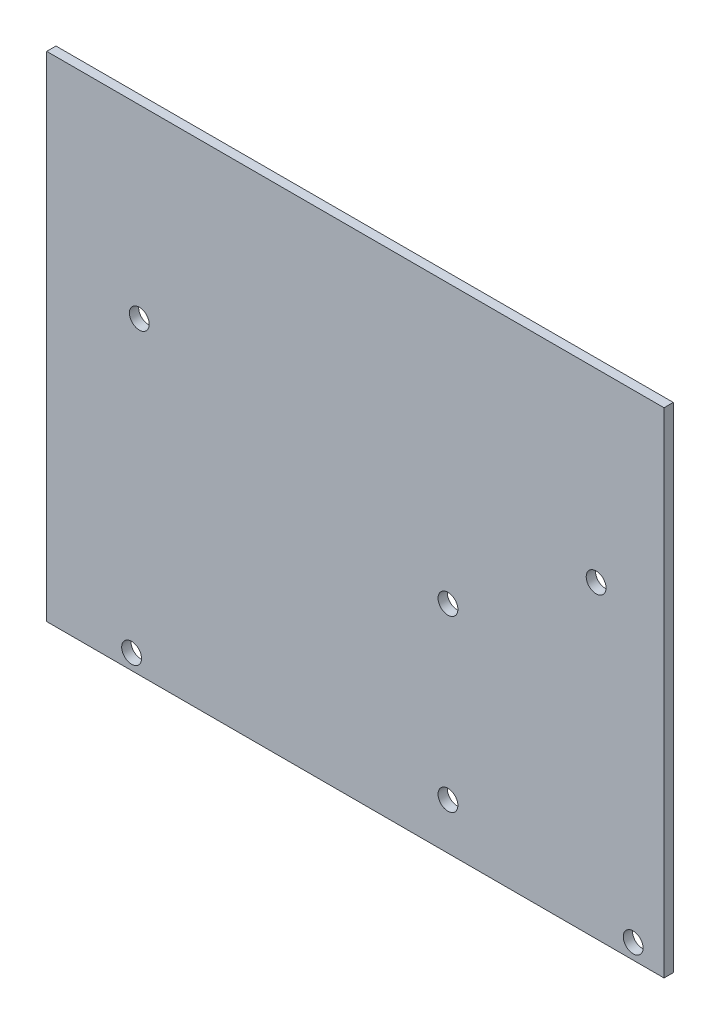
from build123d import *

# Parameters (mm, degrees)
SKETCH1_W             = 101.6
SKETCH1_H             = 81.28
BOSS_EXTRUDE1_DEPTH   = 0.762
F_4_CLEARANCE_HOLE1_D = 3.2639


with BuildPart() as part:
    # Sketch1 → Boss-Extrude1 (new, symmetric)
    with BuildSketch(Plane.XY):
        Rectangle(SKETCH1_W, SKETCH1_H)
    extrude(amount=BOSS_EXTRUDE1_DEPTH, both=True)

    # #4 Clearance Hole1 (through all)
    with Locations(Plane.XY.offset(0.762)):
        with Locations((-36.83, -38.1), (15.24, -33.02), (15.24, -5.08), (45.72, -38.1), (-35.56, 10.16), (39.624, 10.16)):
            Hole(F_4_CLEARANCE_HOLE1_D / 2)


solid = part.part
